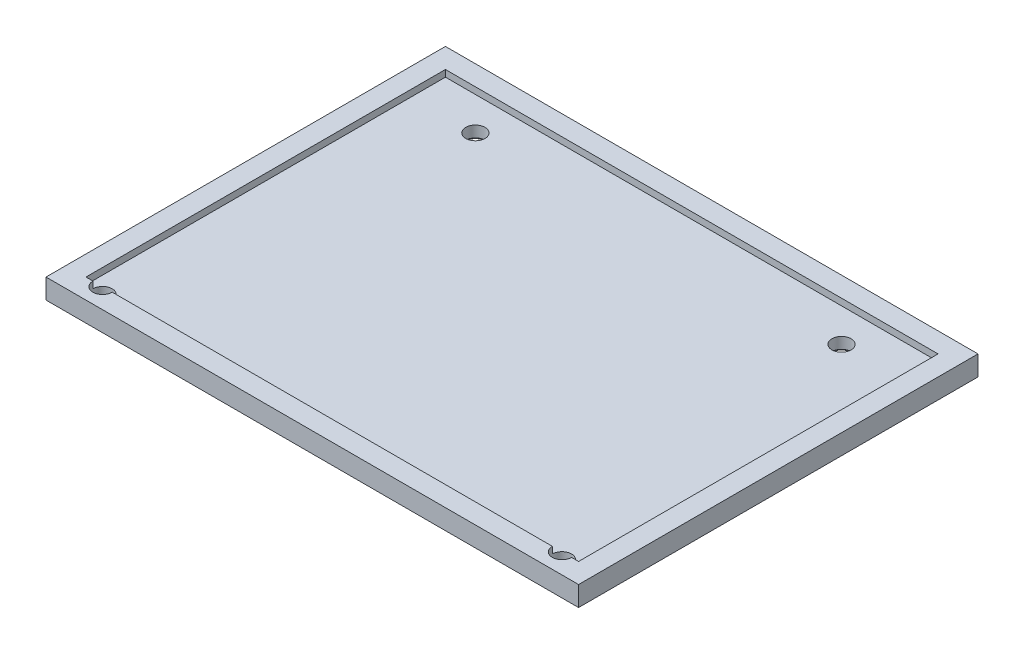
from build123d import *

# Parameters (mm, degrees)
SKETCH_1_W                     = 80
SKETCH_1_H                     = 60
EXTRUDE_1_DEPTH                = 2
SKETCH_2_W                     = 74
SKETCH_2_H                     = 54
EXTRUDE_2_DEPTH                = 1
HOLE_WIZARD_M3_5_1_D           = 2.9
HOLE_WIZARD_M3_5_1_DEPTH       = 8.8
HOLE_WIZARD_M3_5_1_CSINK_D     = 3.55
HOLE_WIZARD_M3_5_1_CSINK_ANGLE = 90
HOLE_WIZARD_M3_5_1_TIP         = 0.871247898


with BuildPart() as part:
    # 草图1 → 凸台-拉伸1 (new body)
    with BuildSketch(Plane(origin=(0, 0, 0), x_dir=(1, 0, 0), z_dir=(0, 1, 0))):
        with Locations((40, 30)):
            Rectangle(SKETCH_1_W, SKETCH_1_H)
    extrude(amount=EXTRUDE_1_DEPTH)

    # 草图2 → 凸台-拉伸2 (add)
    with BuildSketch(Plane(origin=(0, 2, 0), x_dir=(1, 0, 0), z_dir=(0, 1, 0))):
        Polygon((80, 60), (0, 60), (0, 57), (0, 0), (80, 0), align=None)
        with Locations((40, 30)):
            Rectangle(SKETCH_2_W, SKETCH_2_H, mode=Mode.SUBTRACT)
    extrude(amount=EXTRUDE_2_DEPTH)

    # M3.5 螺纹孔1
    with Locations(Plane.XZ):
        with Locations((5.5, -3), (74.5, -3), (12.5, -52), (67.5, -52)):
            CounterSinkHole(HOLE_WIZARD_M3_5_1_D / 2, HOLE_WIZARD_M3_5_1_CSINK_D / 2, depth=HOLE_WIZARD_M3_5_1_DEPTH, counter_sink_angle=HOLE_WIZARD_M3_5_1_CSINK_ANGLE)
            with Locations((0, 0, -(HOLE_WIZARD_M3_5_1_DEPTH + HOLE_WIZARD_M3_5_1_TIP / 2))):  # 118° drill point
                Cone(0, HOLE_WIZARD_M3_5_1_D / 2, HOLE_WIZARD_M3_5_1_TIP, mode=Mode.SUBTRACT)


solid = part.part
